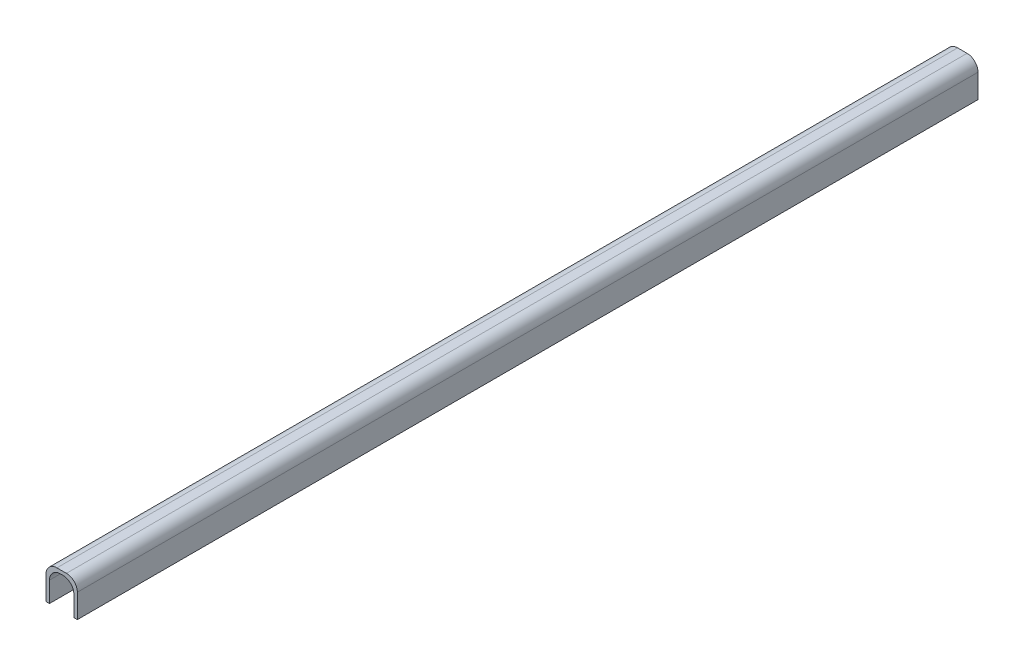
from build123d import *

# Parameters (mm, degrees)
BOSS_EXTRUDE1_DEPTH = 825


with BuildPart() as part:
    # Sketch1 → Boss-Extrude1 (new body)
    with BuildSketch(Plane.XY):
        with BuildLine():
            Line((3.175, 0), (3.175, 18.575))
            ThreePointArc((3.175, 18.575), (6.103932188, 25.646067812), (13.175, 28.575))
            Line((13.175, 28.575), (15.527, 28.575))
            ThreePointArc((15.527, 28.575), (22.598067812, 25.646067812), (25.527, 18.575))
            Line((25.527, 18.575), (25.527, 0))
            Line((25.527, 0), (28.702, 0))
            Line((28.702, 0), (28.702, 21.75))
            ThreePointArc((28.702, 21.75), (25.773067812, 28.821067812), (18.702, 31.75))
            Line((18.702, 31.75), (10, 31.75))
            ThreePointArc((10, 31.75), (2.928932188, 28.821067812), (0, 21.75))
            Line((0, 21.75), (0, 0))
            Line((0, 0), (3.175, 0))
        make_face()
    extrude(amount=BOSS_EXTRUDE1_DEPTH)


solid = part.part
